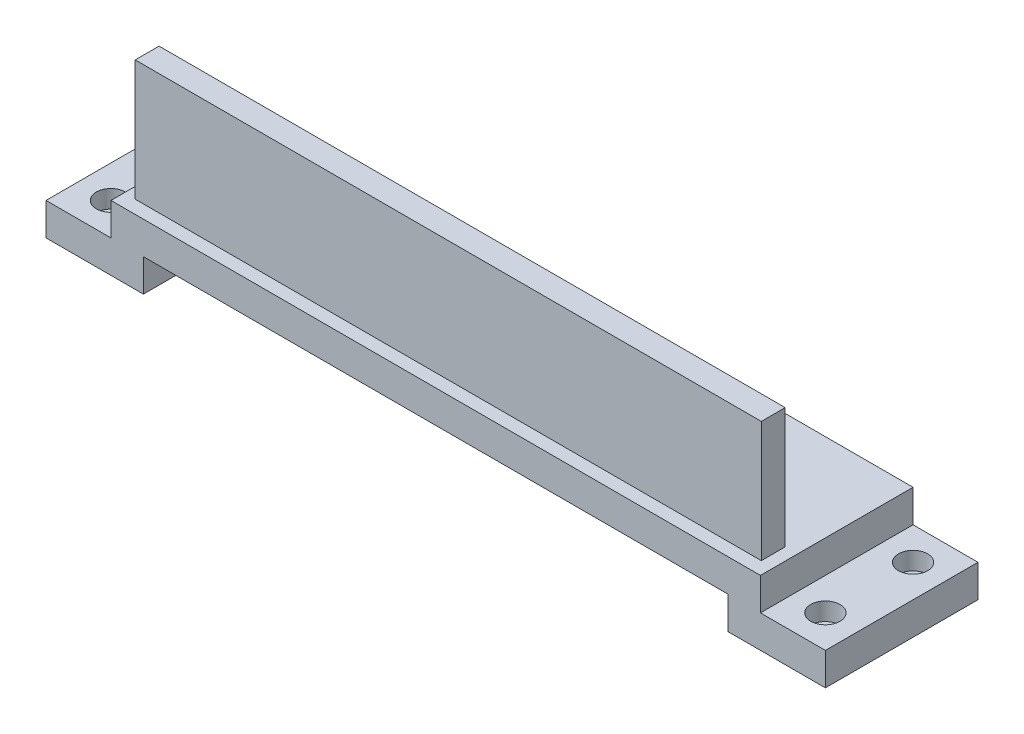
from build123d import *

# Parameters (mm, degrees)
SKETCH_1_W                    = 480
SKETCH_1_H                    = 94
EXTRUDE_1_DEPTH               = 40
SKETCH_2_W                    = 40
SKETCH_2_H                    = 20
CUT_EXTRUDE_1_DEPTH           = 259.526594377
SKETCH_3_W                    = 360
SKETCH_3_H                    = 20
CUT_EXTRUDE_2_DEPTH           = 259.526594377
SKETCH_4_W                    = 40
SKETCH_4_H                    = 20
CUT_EXTRUDE_3_DEPTH           = 259.526594377
HOLE_WIZARD_M10_1_D           = 11
HOLE_WIZARD_M10_1_CBORE_D     = 18
HOLE_WIZARD_M10_1_CBORE_DEPTH = 11
SKETCH_9_W                    = 385.606218599
SKETCH_9_H                    = 14.697127689
EXTRUDE_2_DEPTH               = 74.29


with BuildPart() as part:
    # 草图1 → 凸台-拉伸1 (new body)
    with BuildSketch(Plane.XZ.offset(20)):
        Rectangle(SKETCH_1_W, SKETCH_1_H)
    extrude(amount=-EXTRUDE_1_DEPTH)

    # 草图2 → 切除-拉伸1 (cut, through all)
    with BuildSketch(Plane(origin=(0, 0, -47), x_dir=(-1, 0, 0), z_dir=(0, 0, -1))):
        with Locations((220, 10)):
            Rectangle(SKETCH_2_W, SKETCH_2_H)
    extrude(amount=-CUT_EXTRUDE_1_DEPTH, mode=Mode.SUBTRACT)

    # 草图3 → 切除-拉伸2 (cut, through all)
    with BuildSketch(Plane(origin=(0, 0, -47), x_dir=(-1, 0, 0), z_dir=(0, 0, -1))):
        with Locations((0, -10)):
            Rectangle(SKETCH_3_W, SKETCH_3_H)
    extrude(amount=-CUT_EXTRUDE_2_DEPTH, mode=Mode.SUBTRACT)

    # 草图4 → 切除-拉伸3 (cut, through all)
    with BuildSketch(Plane(origin=(0, 0, -47), x_dir=(-1, 0, 0), z_dir=(0, 0, -1))):
        with Locations((-220, 10)):
            Rectangle(SKETCH_4_W, SKETCH_4_H)
    extrude(amount=-CUT_EXTRUDE_3_DEPTH, mode=Mode.SUBTRACT)

    # M10 六角头螺栓的柱形沉头孔1 (through all)
    with Locations(Plane(origin=(0, 0, 0), x_dir=(1, 0, 0), z_dir=(0, 1, 0))):
        with Locations((220, -27), (220, 27), (-220, -27), (-220, 27)):
            CounterBoreHole(HOLE_WIZARD_M10_1_D / 2, HOLE_WIZARD_M10_1_CBORE_D / 2, HOLE_WIZARD_M10_1_CBORE_DEPTH)

    # 草图9 → 凸台-拉伸2 (add)
    with BuildSketch(Plane(origin=(0, 20, 0), x_dir=(1, 0, 0), z_dir=(0, 1, 0))):
        with Locations((-0.386766518, -31.52147123)):
            Rectangle(SKETCH_9_W, SKETCH_9_H)
    extrude(amount=EXTRUDE_2_DEPTH)


solid = part.part
